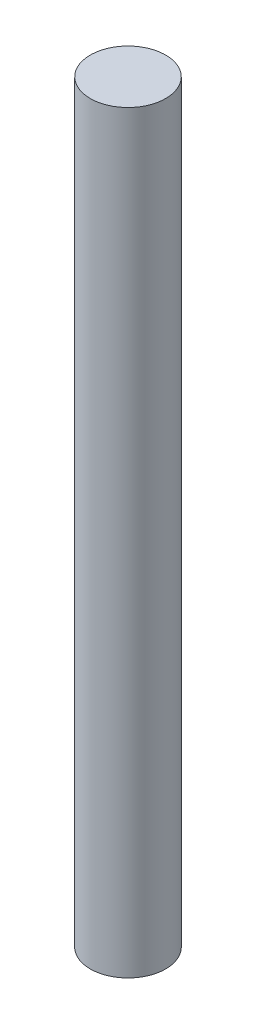
from build123d import *

# Parameters (mm, degrees)
SKETCH_1_R      = 1.5
EXTRUDE_1_DEPTH = 30


with BuildPart() as part:
    # 草圖1 → 伸長1 (new body)
    with BuildSketch(Plane(origin=(0, 0, 0), x_dir=(1, 0, 0), z_dir=(0, 1, 0))):
        with Locations(Location((0, 0, 0), (0, 0, 270))):
            Circle(SKETCH_1_R)
    extrude(amount=EXTRUDE_1_DEPTH)


solid = part.part
